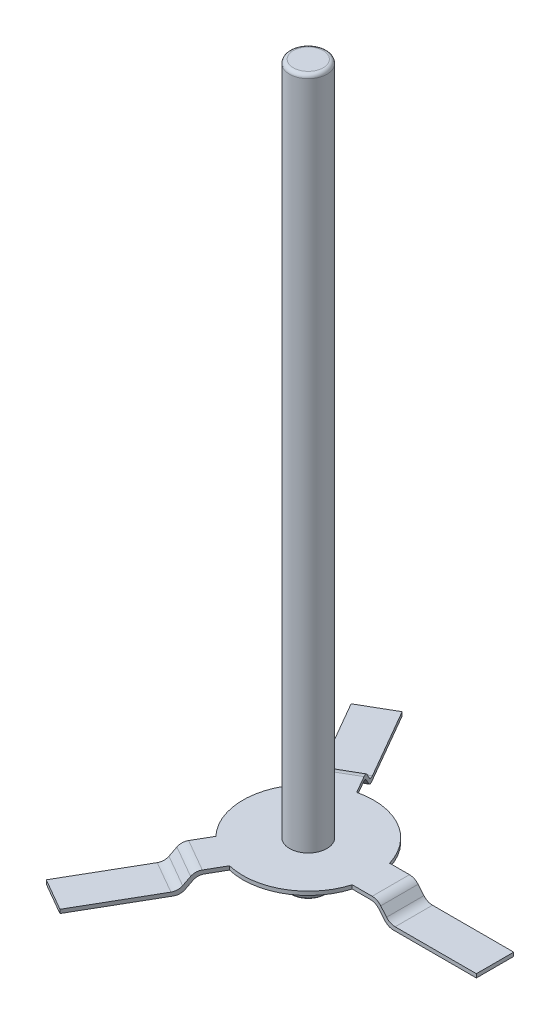
from build123d import *

# Parameters (mm, degrees)
SKETCH_1_R               = 0.5
EXTRUDE_1_DEPTH          = 19.15
SKETCH_2_R               = 1.75
SKETCH_2_R_2             = 0.5
EXTRUDE_2_DEPTH          = 0.1
EXTRUDE_3_DEPTH          = 0.5
PATTERN_CIRCULAR_1_COUNT = 3
FILLET_2_R               = 0.3
FILLET_3_R               = 0.1


with BuildPart() as part:
    # Эскиз1 → Бобышка-Вытянуть1 (new body)
    with BuildSketch(Plane(origin=(0, 0, 0), x_dir=(1, 0, 0), z_dir=(0, 1, 0))):
        with Locations(Location((0, 0, 0), (0, 0, 270))):
            Circle(SKETCH_1_R)
    extrude(amount=EXTRUDE_1_DEPTH)

    # Эскиз2 → Бобышка-Вытянуть2 (add)
    with BuildSketch(Plane(origin=(0, 1, 0), x_dir=(1, 0, 0), z_dir=(0, 1, 0))):
        with Locations(Location((0, 0, 0), (0, 0, 270))):
            Circle(SKETCH_2_R)
        with Locations(Location((0, 0, 0), (0, 0, 270))):
            Circle(SKETCH_2_R_2, mode=Mode.SUBTRACT)
    extrude(amount=EXTRUDE_2_DEPTH)

    # Эскиз3 → Бобышка-Вытянуть3 (add, symmetric)
    with BuildSketch(Plane.XY):
        Polygon((1.5, 1), (2.303369234, 1), (2.639009087, 0.6), (5, 0.6), (5, 0.7), (2.685639852, 0.7), (2.35, 1.1), (1.5, 1.1), align=None)
    extrude_3 = extrude(amount=EXTRUDE_3_DEPTH, both=True)

    # Круговой массив1: Бобышка-Вытянуть3 ×3 about axis
    pattern_circular_1_axis = Axis((0, 0, 0), (0, 1, 0))
    for i in range(1, PATTERN_CIRCULAR_1_COUNT):
        add(extrude_3.rotate(pattern_circular_1_axis, i * 360 / PATTERN_CIRCULAR_1_COUNT))

    # Скругление2
    fillet_2_edges = [part.edges().sort_by_distance(p)[0] for p in [
        (2.303369234, 1, 0),
        (2.639009087, 0.6, 0),
        (2.685639852, 0.7, 0),
        (2.35, 1.1, 0),
        (-1.151684617, 1, -1.994776271),
        (-1.319504543, 0.6, -2.28544891),
        (-1.342819926, 0.7, -2.325832338),
        (-1.175, 1.1, -2.035159699),
        (-1.151684617, 1, 1.994776271),
        (-1.319504543, 0.6, 2.28544891),
        (-1.342819926, 0.7, 2.325832338),
        (-1.175, 1.1, 2.035159699),
    ]]
    fillet(fillet_2_edges, radius=FILLET_2_R)

    # Скругление3
    fillet_3_edges = [part.edges().sort_by_distance(p)[0] for p in [
        (0, 0, -0.5),
        (0, 19.15, -0.5),
    ]]
    fillet(fillet_3_edges, radius=FILLET_3_R)


solid = part.part
